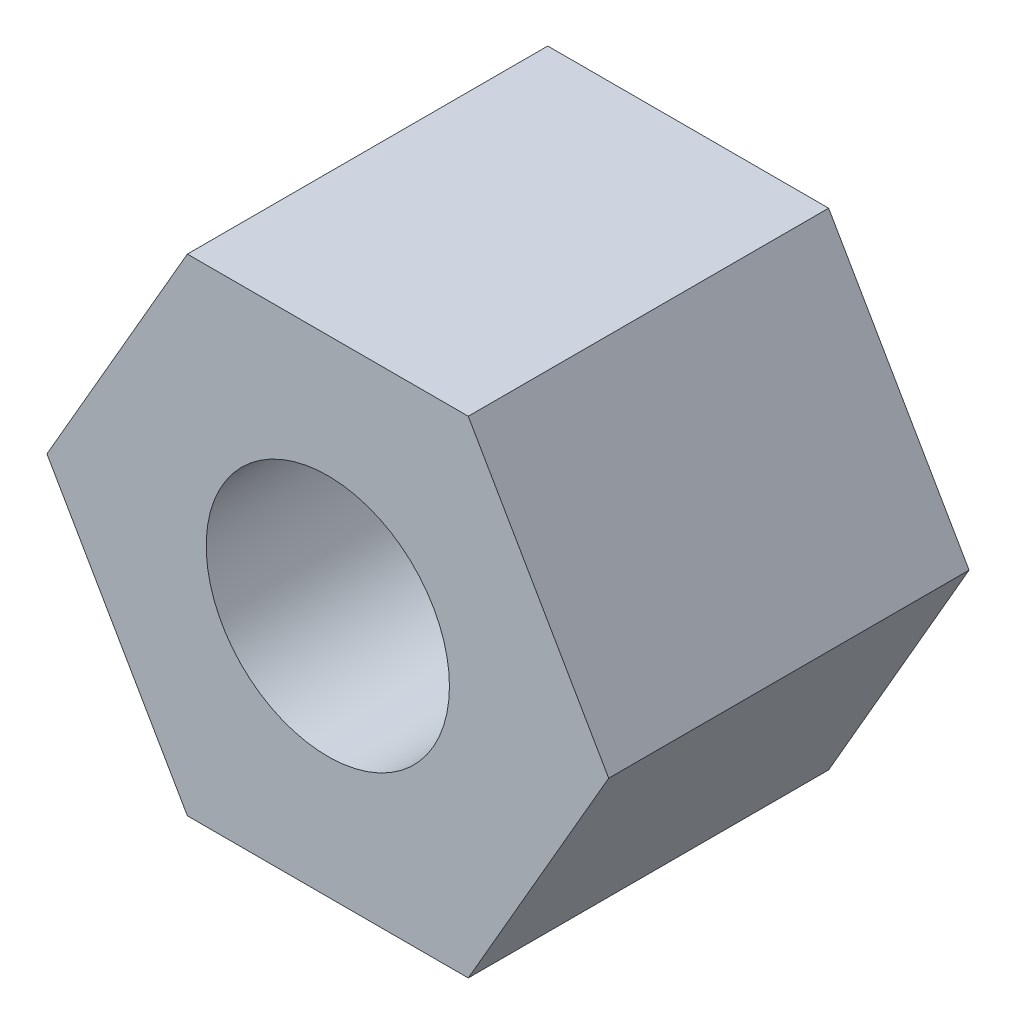
from build123d import *

# Parameters (mm, degrees)
SKETCH1_R           = 1.35
BOSS_EXTRUDE1_DEPTH = 4


with BuildPart() as part:
    # Sketch1 → Boss-Extrude1 (new body)
    with BuildSketch(Plane.XY):
        Polygon((3.117691454, 0), (1.558845727, 2.7), (-1.558845727, 2.7), (-3.117691454, 0), (-1.558845727, -2.7), (1.558845727, -2.7), align=None)
        Circle(SKETCH1_R, mode=Mode.SUBTRACT)
    extrude(amount=BOSS_EXTRUDE1_DEPTH)


solid = part.part
